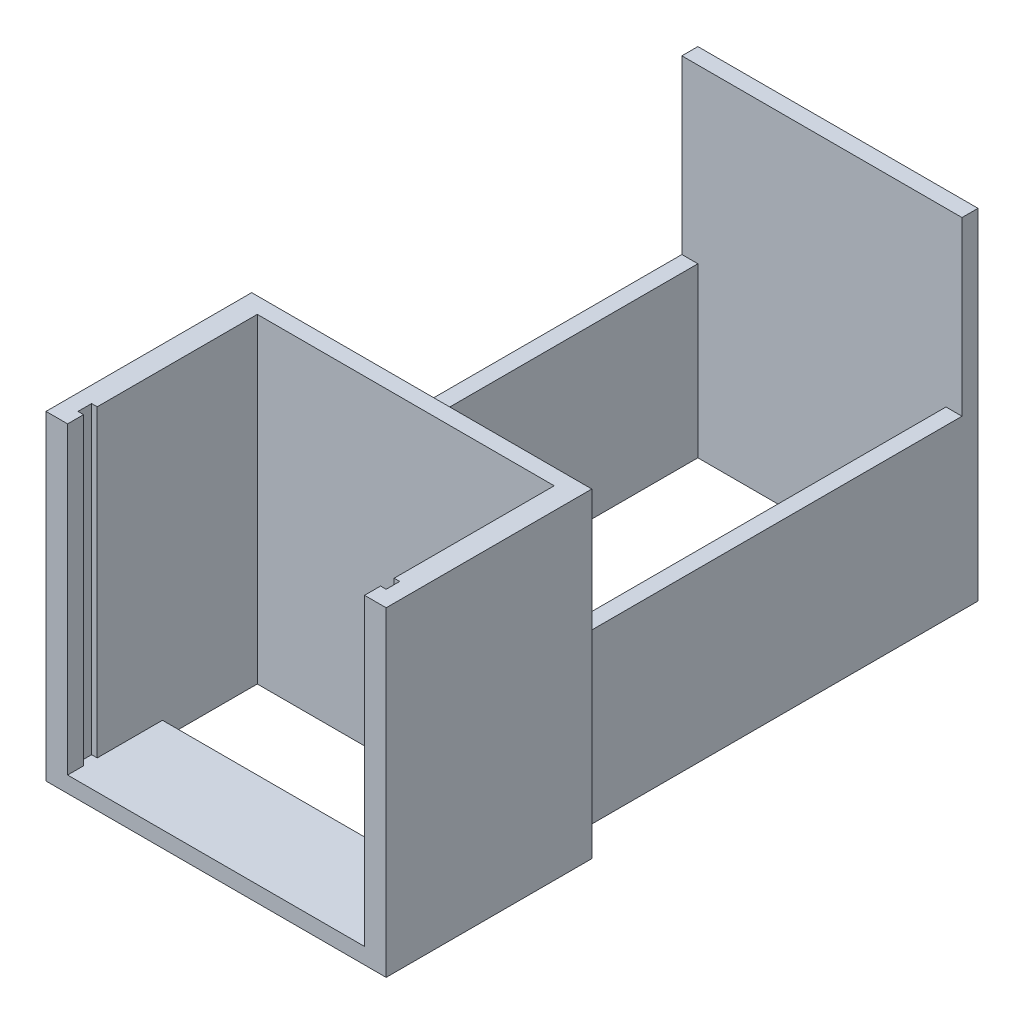
from build123d import *

# Parameters (mm, degrees)
BOSS_EXTRUDE1_DEPTH   = 38
BOSS_EXTRUDE1_2_DEPTH = 38
SKETCH2_W             = 42.5
SKETCH2_H             = 5.7
BOSS_EXTRUDE2_DEPTH   = 2
BOSS_EXTRUDE3_DEPTH   = 18
SKETCH4_W             = 42.5
SKETCH4_H             = 40
BOSS_EXTRUDE4_DEPTH   = 2
SKETCH5_W             = 37.1
SKETCH5_H             = 11.85
CUT_EXTRUDE1_DEPTH    = 81.281509747
SKETCH6_W             = 2
SKETCH6_H             = 21
BOSS_EXTRUDE6_DEPTH   = 50
BOSS_EXTRUDE7_DEPTH   = 42.5


with BuildPart() as part:
    # Sketch1 → Boss-Extrude1 (new body)
    with BuildSketch(Plane(origin=(0, 0, 0), x_dir=(1, 0, 0), z_dir=(0, 1, 0))):
        Polygon((-62.898983402, -26.09346473), (-62.898983402, -24.39346473), (-62.198983402, -24.39346473), (-62.198983402, -22.39346473), (-64.898983402, -22.39346473), (-64.898983402, -28.09346473), (-62.198983402, -28.09346473), (-62.198983402, -26.09346473), align=None)
    extrude(amount=BOSS_EXTRUDE1_DEPTH)



with BuildPart() as body_2:
    # Sketch1 → Boss-Extrude1 2 (new body)
    with BuildSketch(Plane(origin=(0, 0, 0), x_dir=(1, 0, 0), z_dir=(0, 1, 0))):
        Polygon((-25.098983402, -22.39346473), (-25.098983402, -24.39346473), (-24.398983402, -24.39346473), (-24.398983402, -26.09346473), (-25.098983402, -26.09346473), (-25.098983402, -28.09346473), (-22.398983402, -28.09346473), (-22.398983402, -22.39346473), align=None)
    extrude(amount=BOSS_EXTRUDE1_2_DEPTH)


with BuildPart() as part_1:
    add(part.part)

    add(body_2.part)  # Boss-Extrude2 merges body 2
    # Sketch2 → Boss-Extrude2 (add)
    with BuildSketch(Plane(origin=(0, 0, 0), x_dir=(1, 0, 0), z_dir=(0, 1, 0))):
        with Locations((-43.648983402, -25.24346473)):
            Rectangle(SKETCH2_W, SKETCH2_H)
    extrude(amount=-BOSS_EXTRUDE2_DEPTH)

    # Sketch3 → Boss-Extrude3 (add)
    with BuildSketch(Plane(origin=(0, 0, 22.39346473), x_dir=(-1, 0, 0), z_dir=(0, 0, -1))):
        Polygon((64.898983402, 38), (62.198983402, 38), (62.198983402, 0), (25.098983402, 0), (25.098983402, 38), (22.398983402, 38), (22.398983402, -2), (64.898983402, -2), align=None)
    extrude(amount=BOSS_EXTRUDE3_DEPTH)

    # Sketch4 → Boss-Extrude4 (add)
    with BuildSketch(Plane(origin=(0, 0, 4.39346473), x_dir=(-1, 0, 0), z_dir=(0, 0, -1))):
        with Locations((43.648983402, 18)):
            Rectangle(SKETCH4_W, SKETCH4_H)
    extrude(amount=BOSS_EXTRUDE4_DEPTH)

    # Sketch5 → Cut-Extrude1 (cut, through all)
    with BuildSketch(Plane(origin=(0, 0, 0), x_dir=(1, 0, 0), z_dir=(0, 1, 0))):
        with Locations((-43.648983402, -10.31846473)):
            Rectangle(SKETCH5_W, SKETCH5_H)
    extrude(amount=-CUT_EXTRUDE1_DEPTH, mode=Mode.SUBTRACT)

    # Sketch6 → Boss-Extrude6 (add)
    with BuildSketch(Plane(origin=(0, 0, 2.39346473), x_dir=(-1, 0, 0), z_dir=(0, 0, -1))):
        with Locations((27.148983402, 8.5)):
            Rectangle(SKETCH6_W, SKETCH6_H)
        with Locations((60.148983402, 8.5)):
            Rectangle(SKETCH6_W, SKETCH6_H)
    extrude(amount=BOSS_EXTRUDE6_DEPTH)

    # Sketch7 → Boss-Extrude7 (add)
    with BuildSketch(Plane.XZ.offset(2)):
        Polygon((-59.148983402, -47.60653527), (-61.148983402, -47.60653527), (-61.148983402, -49.60653527), (-26.148983402, -49.60653527), (-26.148983402, -47.60653527), (-28.148983402, -47.60653527), align=None)
    extrude(amount=-BOSS_EXTRUDE7_DEPTH)


solid = part_1.part
